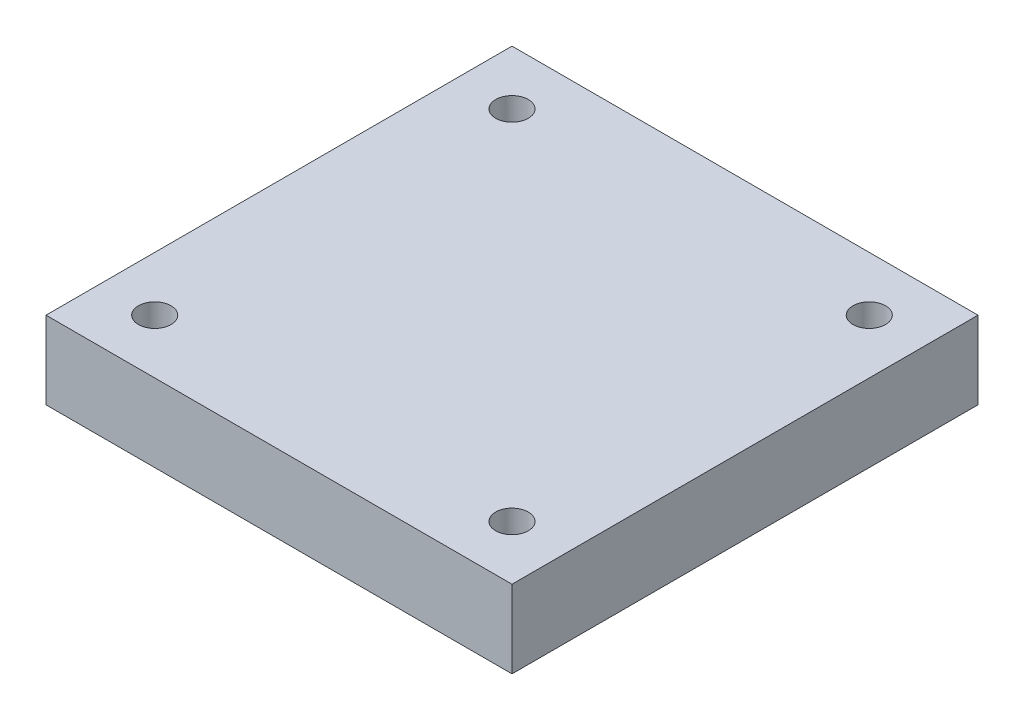
from build123d import *

# Parameters (mm, degrees)
SKETCH1_W           = 60
SKETCH1_H           = 60
BOSS_EXTRUDE1_DEPTH = 10
M5_TAPPED_HOLE1_D   = 4.2


with BuildPart() as part:
    # Sketch1 → Boss-Extrude1 (new body)
    with BuildSketch(Plane(origin=(0, 0, 0), x_dir=(1, 0, 0), z_dir=(0, 1, 0))):
        Rectangle(SKETCH1_W, SKETCH1_H)
    extrude(amount=BOSS_EXTRUDE1_DEPTH)

    # M5 Tapped Hole1 (through all)
    with Locations(Plane(origin=(-23, 10, -23), x_dir=(0, 0, 1), z_dir=(0, 1, 0))):
        with Locations((0, 0), (0, 46), (46, 46), (46, 0)):
            Hole(M5_TAPPED_HOLE1_D / 2)


solid = part.part
